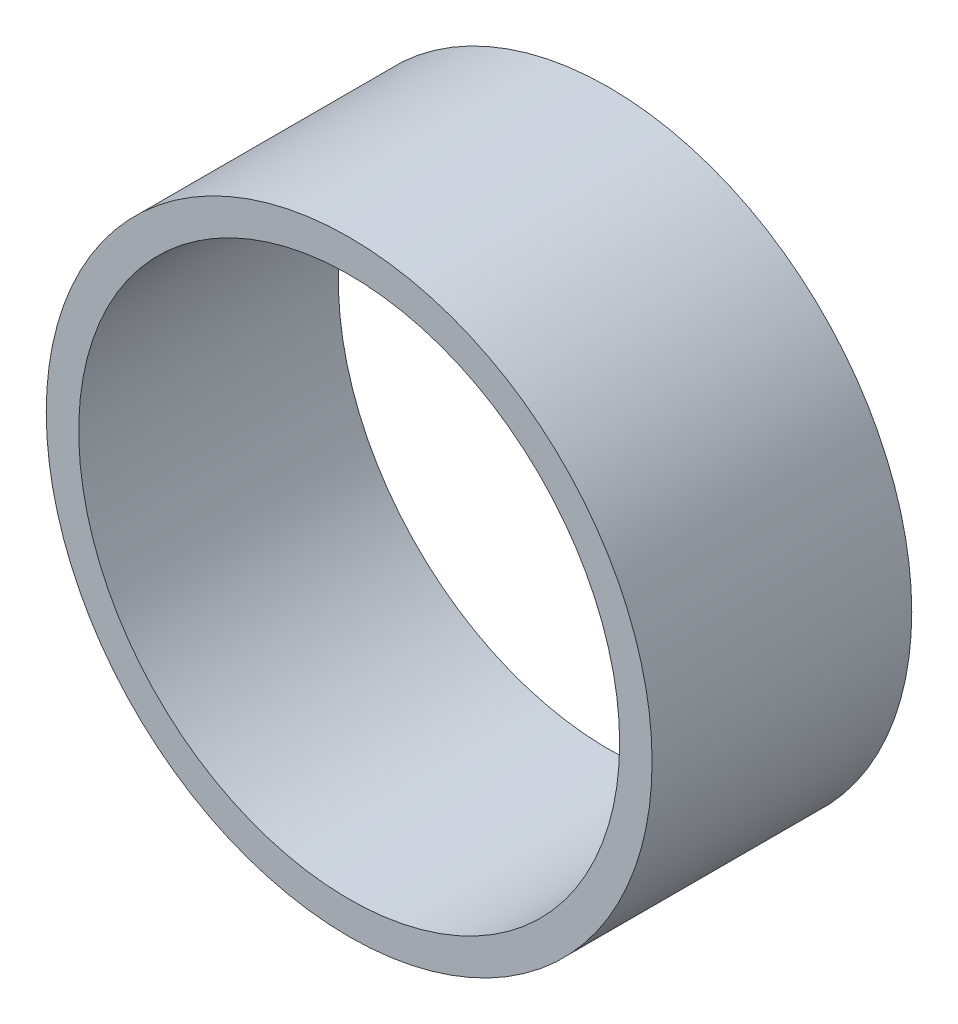
from build123d import *

# Parameters (mm, degrees)
SKETCH1_R           = 14
SKETCH1_R_2         = 12.5
BOSS_EXTRUDE1_DEPTH = 12


with BuildPart() as part:
    # Sketch1 → Boss-Extrude1 (new body)
    with BuildSketch(Plane.XY):
        Circle(SKETCH1_R)
        Circle(SKETCH1_R_2, mode=Mode.SUBTRACT)
    extrude(amount=BOSS_EXTRUDE1_DEPTH)


solid = part.part
